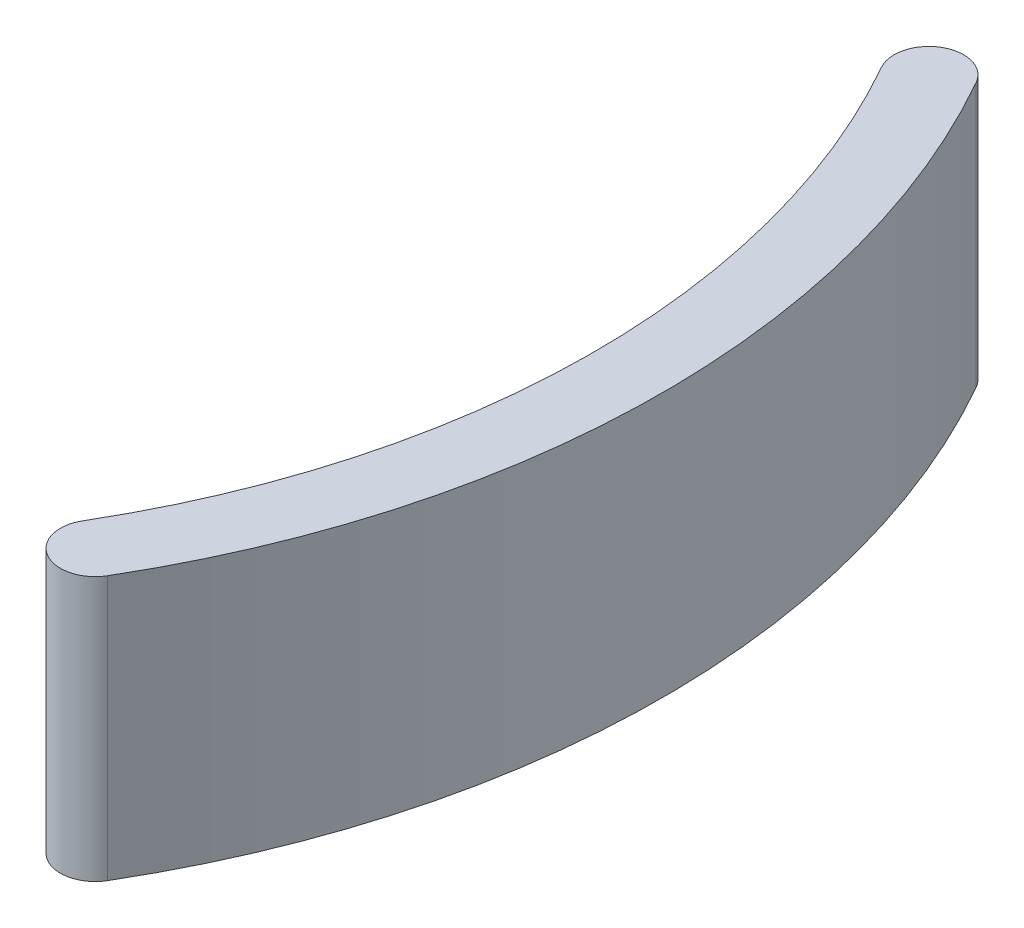
from build123d import *

# Parameters (mm, degrees)
BOSS_EXTRUDE1_DEPTH = 38


with BuildPart() as part:
    # Sketch1 → Boss-Extrude1 (new body)
    with BuildSketch(Plane(origin=(0, 0, 0), x_dir=(1, 0, 0), z_dir=(0, 1, 0))):
        with BuildLine():
            ThreePointArc((-12.121553216, -61.902554318), (4.999831437, -0.041056031), (-11.103363648, 62.093265329))
            ThreePointArc((-11.103363648, 62.093265329), (-17.918232856, 63.979414231), (-19.804381758, 57.164545023))
            ThreePointArc((-19.804381758, 57.164545023), (-4.999831437, 0.041056031), (-20.740459264, -56.831611749))
            ThreePointArc((-20.740459264, -56.831611749), (-18.966477525, -63.676536058), (-12.121553216, -61.902554318))
        make_face()
    extrude(amount=BOSS_EXTRUDE1_DEPTH)


solid = part.part
